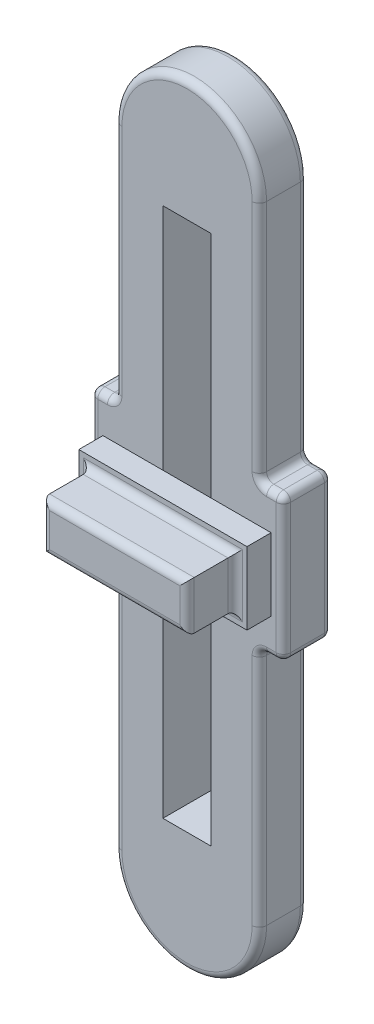
from build123d import *

# Parameters (mm, degrees)
SKETCH1_W           = 20
SKETCH1_H           = 220
BOSS_EXTRUDE1_DEPTH = 10
SKETCH2_W           = 60
SKETCH2_H           = 20
BOSS_EXTRUDE2_DEPTH = 30
SKETCH3_W           = 69.73889917
SKETCH3_H           = 30
SKETCH3_W_2         = 60
SKETCH3_H_2         = 20
BOSS_EXTRUDE3_DEPTH = 10
FILLET2_R           = 3


with BuildPart() as part:
    # Sketch1 → Boss-Extrude1 (new, symmetric)
    with BuildSketch(Plane.XY):
        with BuildLine():
            Line((30, 130), (30, 30))
            Line((30, 30), (40, 30))
            Line((40, 30), (40, -30))
            Line((40, -30), (30, -30))
            Line((30, -30), (30, -130))
            ThreePointArc((30, -130), (0, -160), (-30, -130))
            Line((-30, -130), (-30, -30))
            Line((-30, -30), (-40, -30))
            Line((-40, -30), (-40, 30))
            Line((-40, 30), (-30, 30))
            Line((-30, 30), (-30, 130))
            ThreePointArc((-30, 130), (0, 160), (30, 130))
        make_face()
        Rectangle(SKETCH1_W, SKETCH1_H, mode=Mode.SUBTRACT)
    extrude(amount=BOSS_EXTRUDE1_DEPTH, both=True)

    # Sketch2 → Boss-Extrude2 (add)
    with BuildSketch(Plane.XY.offset(10)):
        Rectangle(SKETCH2_W, SKETCH2_H)
    extrude(amount=BOSS_EXTRUDE2_DEPTH)

    # Sketch3 → Boss-Extrude3 (add)
    with BuildSketch(Plane.XY.offset(10)):
        Rectangle(SKETCH3_W, SKETCH3_H)
        Rectangle(SKETCH3_W_2, SKETCH3_H_2, mode=Mode.SUBTRACT)
    extrude(amount=BOSS_EXTRUDE3_DEPTH)

    # Fillet2
    fillet2_edges = [part.edges().sort_by_distance(p)[0] for p in [
        (30, 80, -10),
        (35, 30, -10),
        (-35, 30, 10),
        (40, 0, -10),
        (35, -30, -10),
        (30, -80, -10),
        (0, -160, -10),
        (-30, -80, -10),
        (-35, -30, -10),
        (-40, 0, -10),
        (-35, 30, -10),
        (-30, 80, -10),
        (0, 160, -10),
        (-40, 0, 10),
        (30, 30, 0),
        (40, 30, 0),
        (-35, -30, 10),
        (40, -30, 0),
        (30, -30, 0),
        (-30, -30, 0),
        (-40, -30, 0),
        (-40, 30, 0),
        (-30, 30, 0),
        (-30, -80, 10),
        (0, -160, 10),
        (30, -80, 10),
        (35, -30, 10),
        (40, 0, 10),
        (35, 30, 10),
        (30, 80, 10),
        (0, 160, 10),
        (30, 0, 40),
        (0, 10, 40),
        (-30, 0, 40),
        (0, -10, 40),
        (30, 0, 20),
        (0, 10, 20),
        (-30, 0, 20),
        (0, -10, 20),
        (-30, 80, 10),
    ]]
    fillet(fillet2_edges, radius=FILLET2_R)


solid = part.part
